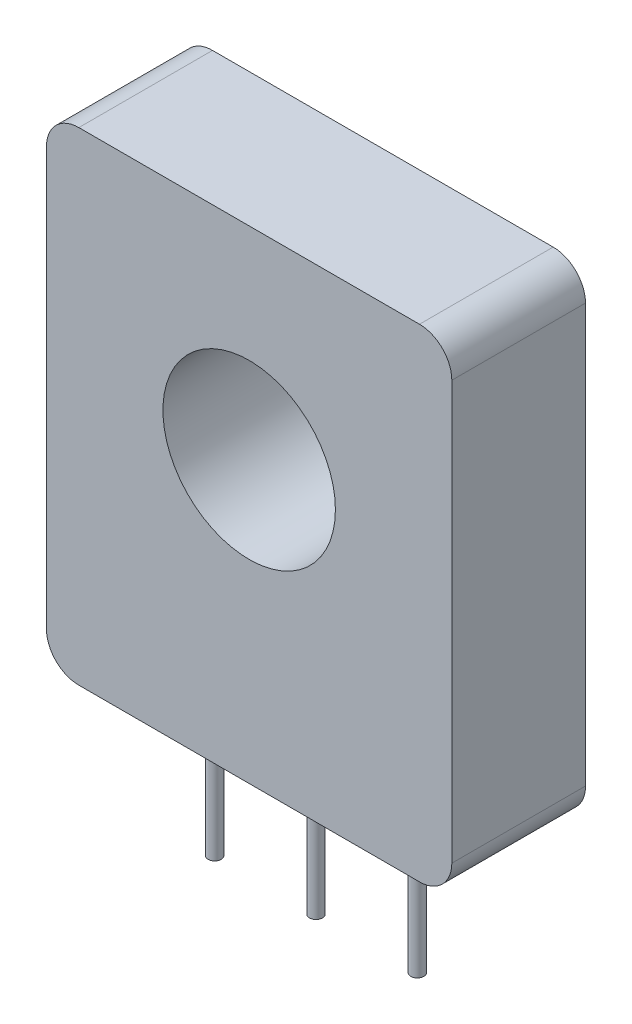
from build123d import *

# Parameters (mm, degrees)
EXT_BODY_DEPTH          = 1.55
CUT_POT_HOLE_DEPTH      = 15.946906034
CUT_POT_HOLE_DEPTH_BACK = 15.946906034
SKETCH2_R               = 2
SKETCH5_R               = 0.15
EXT_PINS_DEPTH          = 3.4


with BuildPart() as part:
    # Sketch1 → ext-body (new, symmetric)
    with BuildSketch(Plane.XY):
        with BuildLine():
            Line((0.75, 0), (8.65, 0))
            ThreePointArc((8.65, 0), (9.180330086, 0.219669914), (9.4, 0.75))
            Line((9.4, 0.75), (9.4, 10.45))
            ThreePointArc((9.4, 10.45), (9.180330086, 10.980330086), (8.65, 11.2))
            Line((8.65, 11.2), (0.75, 11.2))
            ThreePointArc((0.75, 11.2), (0.219669914, 10.980330086), (0, 10.45))
            Line((0, 10.45), (0, 0.75))
            ThreePointArc((0, 0.75), (0.219669914, 0.219669914), (0.75, 0))
        make_face()
    extrude(amount=EXT_BODY_DEPTH, both=True)

    # Sketch2 → cut-pot_hole (cut, two sides: drawn at the far end of the back side and taken through both)
    with BuildSketch(Plane.XY.offset(1.55).offset(-CUT_POT_HOLE_DEPTH_BACK)):
        with Locations((4.7, 6.5)):
            Circle(SKETCH2_R)
    extrude(amount=CUT_POT_HOLE_DEPTH + CUT_POT_HOLE_DEPTH_BACK, mode=Mode.SUBTRACT)

    # Sketch5 → ext-pins (add)
    with BuildSketch(Plane.XZ):
        with Locations(Location((2.35, 0, 0), (0, 0, 90))):
            Circle(SKETCH5_R)
        with Locations(Location((4.7, 0, 0), (0, 0, 90))):
            Circle(SKETCH5_R)
        with Locations(Location((7.05, 0, 0), (0, 0, 90))):
            Circle(SKETCH5_R)
    extrude(amount=EXT_PINS_DEPTH)


solid = part.part
